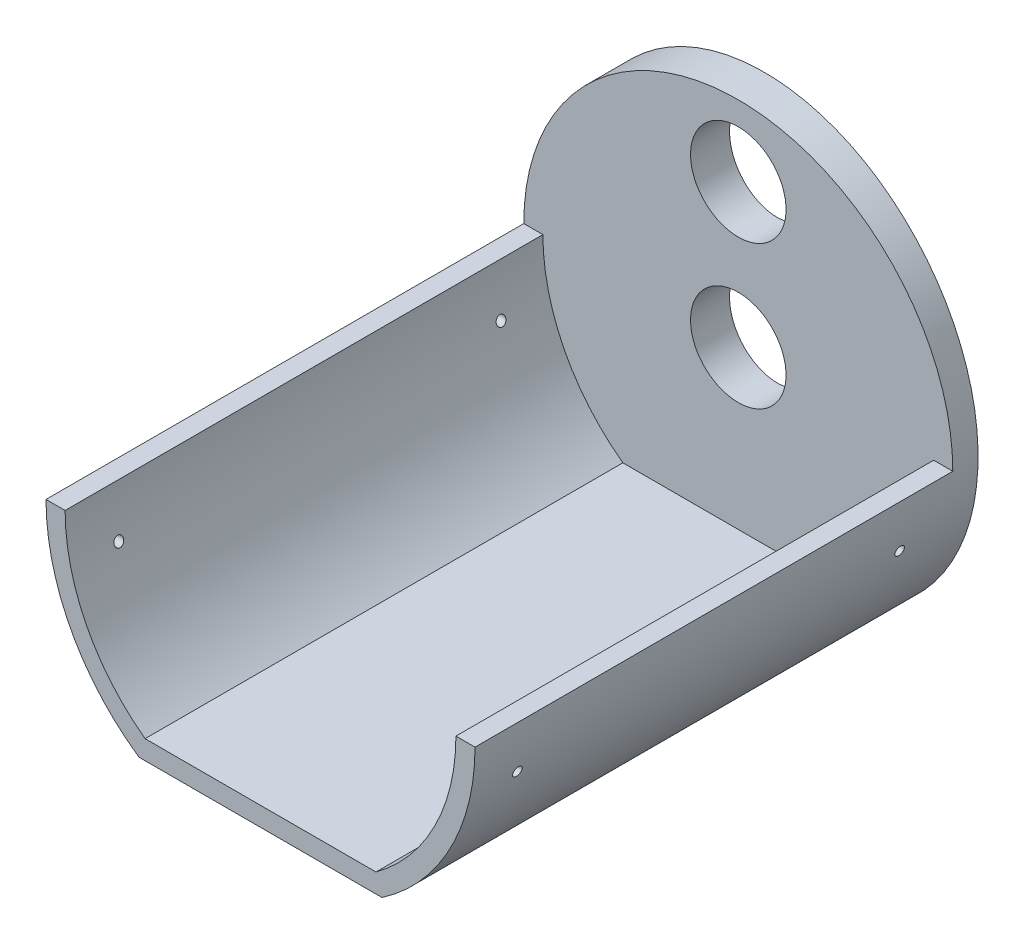
from build123d import *

# Parameters (mm, degrees)
SKETCH1_R               = 22.45
BOSS_EXTRUDE1_DEPTH     = 5
SKETCH2_R               = 5
CUT_EXTRUDE1_DEPTH      = 5
BOSS_EXTRUDE2_DEPTH     = 50
BOSS_EXTRUDE5_DEPTH     = 50
CUT_EXTRUDE3_DEPTH      = 64.505944604
CUT_EXTRUDE3_DEPTH_BACK = 64.505944604
CUT_EXTRUDE4_DEPTH      = 64.505944604
CUT_EXTRUDE4_DEPTH_BACK = 64.505944604
SKETCH7_R               = 0.5


with BuildPart() as part:
    # Sketch1 → Boss-Extrude1 (new body)
    with BuildSketch(Plane.XY):
        Circle(SKETCH1_R)
    extrude(amount=BOSS_EXTRUDE1_DEPTH)

    # Sketch2 → Cut-Extrude1 (cut)
    with BuildSketch(Plane(origin=(0, 0, 0), x_dir=(-1, 0, 0), z_dir=(0, 0, -1))):
        Circle(SKETCH2_R)
        with Locations((0, 15)):
            Circle(SKETCH2_R)
    extrude(amount=-CUT_EXTRUDE1_DEPTH, mode=Mode.SUBTRACT)

    # Sketch3 → Boss-Extrude2 (add)
    with BuildSketch(Plane.XY.offset(5)):
        with BuildLine():
            Line((-12.718195627, -18.5), (12.718195627, -18.5))
            ThreePointArc((12.718195627, -18.5), (14.006550731, -17.544772344), (15.223419458, -16.5))
            Line((15.223419458, -16.5), (-15.223419458, -16.5))
            ThreePointArc((-15.223419458, -16.5), (-14.006550731, -17.544772344), (-12.718195627, -18.5))
        make_face()
    extrude(amount=BOSS_EXTRUDE2_DEPTH)

    # Sketch5 → Boss-Extrude5 (add)
    with BuildSketch(Plane.XY.offset(5)):
        with BuildLine():
            Line((-15.223419458, -16.5), (-12.08108025, -16.5))
            ThreePointArc((-12.08108025, -16.5), (-12.994947259, -15.790308602), (-13.867212825, -15.030066815))
            ThreePointArc((-13.867212825, -15.030066815), (-18.732151535, -8.204206169), (-20.45, 0))
            Line((-20.45, 0), (-22.45, 0))
            ThreePointArc((-22.45, 0), (-20.564146795, -9.006573521), (-15.223419458, -16.5))
        make_face()
        with BuildLine():
            Line((20.45, 0), (22.45, 0))
            ThreePointArc((22.45, 0), (20.564146795, -9.006573521), (15.223419458, -16.5))
            Line((15.223419458, -16.5), (12.08108025, -16.5))
            ThreePointArc((12.08108025, -16.5), (12.994947259, -15.790308602), (13.867212825, -15.030066815))
            ThreePointArc((13.867212825, -15.030066815), (18.732151535, -8.204206169), (20.45, 0))
        make_face()
    extrude(amount=BOSS_EXTRUDE5_DEPTH)

    # Sketch6 → Cut-Extrude3 (cut, two sides: drawn at the far end of the back side and taken through both)
    with BuildSketch(Plane(origin=(0, 0, 0), x_dir=(1, 0, 0), z_dir=(0, 1, 0)).offset(-CUT_EXTRUDE3_DEPTH_BACK)):
        Polygon((-22.45, 0), (22.45, 0), (22.45, -2.35310929), align=None)
    extrude(amount=CUT_EXTRUDE3_DEPTH + CUT_EXTRUDE3_DEPTH_BACK, mode=Mode.SUBTRACT)

    # Sketch7 → Cut-Extrude4 (cut, two sides: drawn at the far end of the back side and taken through both)
    with BuildSketch(Plane(origin=(0, 0, 0), x_dir=(0, 0, -1), z_dir=(1, 0, 0)).offset(-CUT_EXTRUDE4_DEPTH_BACK)):
        with Locations((-50, -5)):
            Circle(SKETCH7_R)
        with Locations((-10, -5)):
            Circle(SKETCH7_R)
    extrude(amount=CUT_EXTRUDE4_DEPTH + CUT_EXTRUDE4_DEPTH_BACK, mode=Mode.SUBTRACT)


solid = part.part
